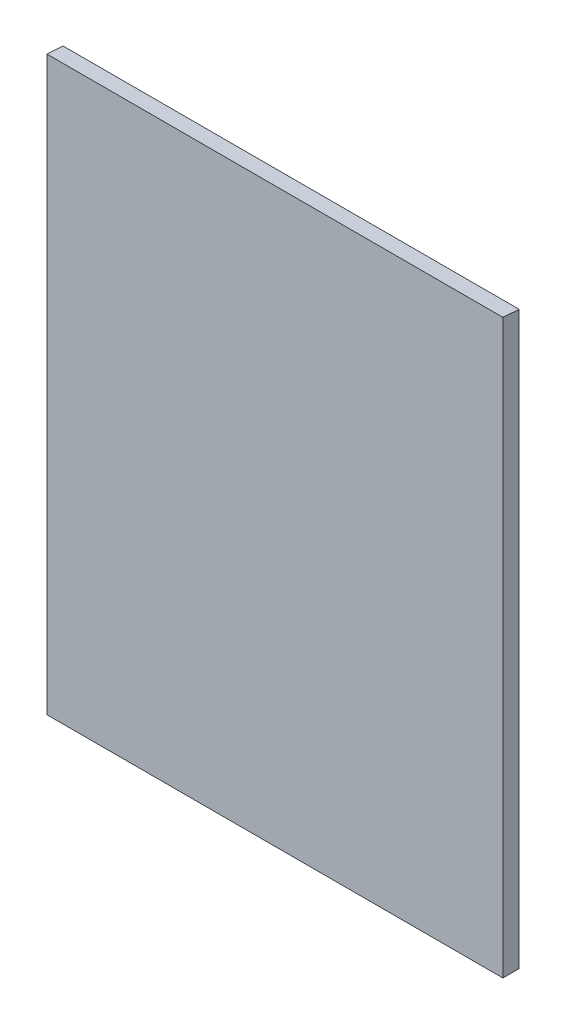
from build123d import *

# Parameters (mm, degrees)
SKETCH1_W           = 533.146
SKETCH1_H           = 668.799499747
BOSS_EXTRUDE1_DEPTH = 19.05
CUT_EXTRUDE1_DEPTH  = 3395.493561919


with BuildPart() as part:
    # Sketch1 → Boss-Extrude1 (new body)
    with BuildSketch(Plane.XY):
        with Locations((0, 3017.909749874)):
            Rectangle(SKETCH1_W, SKETCH1_H)
    extrude(amount=-BOSS_EXTRUDE1_DEPTH)

    # Sketch2 → Cut-Extrude1 (cut, through all)
    with BuildSketch(Plane.ZY.offset(266.573)):
        Polygon((-2.286e-06, 3352.309499747), (-1.425493043, 3371.306090918), (-106.894117253, 3363.3918), (-114.853775761, 3343.690953871), align=None)
    extrude(amount=-CUT_EXTRUDE1_DEPTH, mode=Mode.SUBTRACT)


solid = part.part
